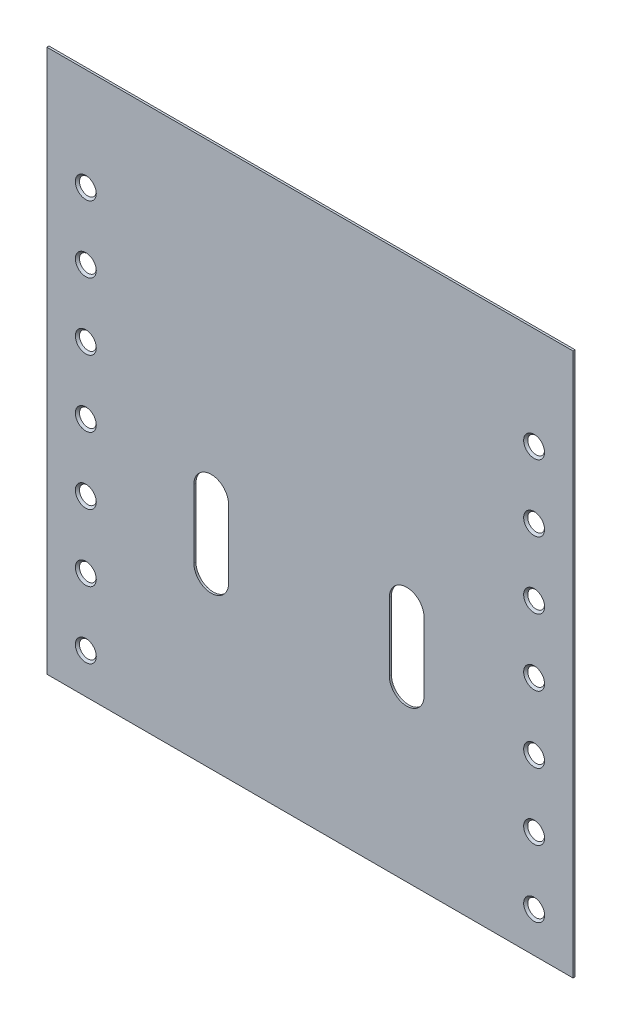
from build123d import *

# Parameters (mm, degrees)
SKETCH1_W                                      = 196.85
SKETCH1_H                                      = 203.2
BOSS_EXTRUDE1_DEPTH                            = 0.7747
CUT_EXTRUDE7_DEPTH                             = 313.185586086
SKETCH4_W                                      = 196.85
SKETCH4_H                                      = 0.6096
BOSS_EXTRUDE2_DEPTH                            = 12
SKETCH14_W                                     = 196.85
SKETCH14_H                                     = 11.938
BOSS_EXTRUDE3_DEPTH                            = 0.7747
SKETCH13_W                                     = 196.85
SKETCH13_H                                     = 0.6096
CUT_EXTRUDE9_DEPTH                             = 12
CSK_FOR_M3_FLAT_HEAD_MACHINE_SCREW3_AT_2_COUNT = 2
CSK_FOR_M3_FLAT_HEAD_MACHINE_SCREW3_AT_2_PITCH = 150
CSK_FOR_M3_FLAT_HEAD_MACHINE_SCREW3_AT_3_COUNT = 2
CSK_FOR_M3_FLAT_HEAD_MACHINE_SCREW3_AT_3_PITCH = 125
CSK_FOR_M3_FLAT_HEAD_MACHINE_SCREW3_AT_4_COUNT = 2
CSK_FOR_M3_FLAT_HEAD_MACHINE_SCREW3_AT_4_PITCH = 100
CSK_FOR_M3_FLAT_HEAD_MACHINE_SCREW3_AT_5_COUNT = 2
CSK_FOR_M3_FLAT_HEAD_MACHINE_SCREW3_AT_5_PITCH = 75
CSK_FOR_M3_FLAT_HEAD_MACHINE_SCREW3_AT_6_COUNT = 2
CSK_FOR_M3_FLAT_HEAD_MACHINE_SCREW3_AT_6_PITCH = 50
CSK_FOR_M3_FLAT_HEAD_MACHINE_SCREW3_AT_7_COUNT = 2
CSK_FOR_M3_FLAT_HEAD_MACHINE_SCREW3_AT_7_PITCH = 25


with BuildPart() as part:
    # Sketch1 → Boss-Extrude1 (new body)
    with BuildSketch(Plane(origin=(0, 0, 0), x_dir=(1, 0, 0), z_dir=(0, 0, -1))):
        with Locations((-104.775, 135.4)):
            Rectangle(SKETCH1_W, SKETCH1_H)
    extrude(amount=BOSS_EXTRUDE1_DEPTH)

    # Sketch2 → Cut-Extrude7 (cut, through all)
    with BuildSketch(Plane(origin=(0, 0, -0.7747), x_dir=(1, 0, 0), z_dir=(0, 0, -1))):
        with BuildLine():
            Line((-135.221253236, 173.5), (-135.221253236, 148))
            ThreePointArc((-135.221253236, 148), (-141.721253236, 141.5), (-148.221253236, 148))
            Line((-148.221253236, 148), (-148.221253236, 173.5))
            ThreePointArc((-148.221253236, 173.5), (-141.721253236, 180), (-135.221253236, 173.5))
        make_face()
        with BuildLine():
            Line((-62.069253236, 173.5), (-62.069253236, 148))
            ThreePointArc((-62.069253236, 148), (-68.569253236, 141.5), (-75.069253236, 148))
            Line((-75.069253236, 148), (-75.069253236, 173.5))
            ThreePointArc((-75.069253236, 173.5), (-68.569253236, 180), (-62.069253236, 173.5))
        make_face()
    extrude(amount=-CUT_EXTRUDE7_DEPTH, mode=Mode.SUBTRACT)

    # Sketch4 → Boss-Extrude2 (add)
    with BuildSketch(Plane.XY):
        with Locations((-104.775, -34.1048)):
            Rectangle(SKETCH4_W, SKETCH4_H)
    extrude(amount=BOSS_EXTRUDE2_DEPTH)

    # Sketch14 → Boss-Extrude3 (add)
    with BuildSketch(Plane.XY):
        with Locations((-104.775, -53.935004147)):
            Rectangle(SKETCH14_W, SKETCH14_H)
    extrude(amount=-BOSS_EXTRUDE3_DEPTH)

    # Sketch13 → Cut-Extrude9 (cut)
    with BuildSketch(Plane.XY.offset(12)):
        with Locations((-104.775, -34.1048)):
            Rectangle(SKETCH13_W, SKETCH13_H)
    extrude(amount=-CUT_EXTRUDE9_DEPTH, mode=Mode.SUBTRACT)

    # Sketch16 → CSK for M3 Flat Head Machine Screw3 (revolve, cut)
    with BuildSketch(Plane(origin=(-188.645, -72, 0), x_dir=(0, -1, 0), z_dir=(1, 0, 0))):
        Polygon((0, 0), (0, 0.7747), (1.7, 0.7747), (1.7, 2.212), (3.912, 0), align=None)
    csk_for_m3_flat_head_machine_screw3 = revolve(axis=Axis((-188.645, -72, 6.35), (0, 0, -1)), mode=Mode.SUBTRACT)

    # CSK for M3 Flat Head Machine Screw3 at 2: CSK for M3 Flat Head Machine Screw3 ×2
    with Locations(*[(0, -i * CSK_FOR_M3_FLAT_HEAD_MACHINE_SCREW3_AT_2_PITCH, 0) for i in range(1, CSK_FOR_M3_FLAT_HEAD_MACHINE_SCREW3_AT_2_COUNT)]):
        add(csk_for_m3_flat_head_machine_screw3, mode=Mode.SUBTRACT)

    # CSK for M3 Flat Head Machine Screw3 at 3: CSK for M3 Flat Head Machine Screw3 ×2
    with Locations(*[(0, -i * CSK_FOR_M3_FLAT_HEAD_MACHINE_SCREW3_AT_3_PITCH, 0) for i in range(1, CSK_FOR_M3_FLAT_HEAD_MACHINE_SCREW3_AT_3_COUNT)]):
        add(csk_for_m3_flat_head_machine_screw3, mode=Mode.SUBTRACT)

    # CSK for M3 Flat Head Machine Screw3 at 4: CSK for M3 Flat Head Machine Screw3 ×2
    with Locations(*[(0, -i * CSK_FOR_M3_FLAT_HEAD_MACHINE_SCREW3_AT_4_PITCH, 0) for i in range(1, CSK_FOR_M3_FLAT_HEAD_MACHINE_SCREW3_AT_4_COUNT)]):
        add(csk_for_m3_flat_head_machine_screw3, mode=Mode.SUBTRACT)

    # CSK for M3 Flat Head Machine Screw3 at 5: CSK for M3 Flat Head Machine Screw3 ×2
    with Locations(*[(0, -i * CSK_FOR_M3_FLAT_HEAD_MACHINE_SCREW3_AT_5_PITCH, 0) for i in range(1, CSK_FOR_M3_FLAT_HEAD_MACHINE_SCREW3_AT_5_COUNT)]):
        add(csk_for_m3_flat_head_machine_screw3, mode=Mode.SUBTRACT)

    # CSK for M3 Flat Head Machine Screw3 at 6: CSK for M3 Flat Head Machine Screw3 ×2
    with Locations(*[(0, -i * CSK_FOR_M3_FLAT_HEAD_MACHINE_SCREW3_AT_6_PITCH, 0) for i in range(1, CSK_FOR_M3_FLAT_HEAD_MACHINE_SCREW3_AT_6_COUNT)]):
        add(csk_for_m3_flat_head_machine_screw3, mode=Mode.SUBTRACT)

    # CSK for M3 Flat Head Machine Screw3 at 7: CSK for M3 Flat Head Machine Screw3 ×2
    with Locations(*[(0, -i * CSK_FOR_M3_FLAT_HEAD_MACHINE_SCREW3_AT_7_PITCH, 0) for i in range(1, CSK_FOR_M3_FLAT_HEAD_MACHINE_SCREW3_AT_7_COUNT)]):
        add(csk_for_m3_flat_head_machine_screw3, mode=Mode.SUBTRACT)

    # Mirror1: CSK for M3 Flat Head Machine Screw3 across plane
    add(csk_for_m3_flat_head_machine_screw3.mirror(Plane.ZY.offset(104.774999995)), mode=Mode.SUBTRACT)

    # Mirror1 copy 1 sketch → Mirror1 copy 1 (revolve, cut)
    with BuildSketch(Plane(origin=(-20.904999999, -222.000000003, 0), x_dir=(-3.839898042745385e-11, -1.0, 0), z_dir=(-1.0, 3.839898042745385e-11, 0))):
        Polygon((0, 0), (0, -0.7747), (1.7, -0.7747), (1.7, -2.212), (3.912, 0), align=None)
    revolve(axis=Axis((-20.904999999, -222.000000003, 6.35), (0, 0, 1)), mode=Mode.SUBTRACT)

    # Mirror1 copy 2 sketch → Mirror1 copy 2 (revolve, cut)
    with BuildSketch(Plane(origin=(-20.904999998, -197.000000003, 0), x_dir=(-3.839898042745385e-11, -1.0, 0), z_dir=(-1.0, 3.839898042745385e-11, 0))):
        Polygon((0, 0), (0, -0.7747), (1.7, -0.7747), (1.7, -2.212), (3.912, 0), align=None)
    revolve(axis=Axis((-20.904999998, -197.000000003, 6.35), (0, 0, 1)), mode=Mode.SUBTRACT)

    # Mirror1 copy 3 sketch → Mirror1 copy 3 (revolve, cut)
    with BuildSketch(Plane(origin=(-20.904999998, -172.000000003, 0), x_dir=(-3.839898042745385e-11, -1.0, 0), z_dir=(-1.0, 3.839898042745385e-11, 0))):
        Polygon((0, 0), (0, -0.7747), (1.7, -0.7747), (1.7, -2.212), (3.912, 0), align=None)
    revolve(axis=Axis((-20.904999998, -172.000000003, 6.35), (0, 0, 1)), mode=Mode.SUBTRACT)

    # Mirror1 copy 4 sketch → Mirror1 copy 4 (revolve, cut)
    with BuildSketch(Plane(origin=(-20.904999997, -147.000000003, 0), x_dir=(-3.839898042745385e-11, -1.0, 0), z_dir=(-1.0, 3.839898042745385e-11, 0))):
        Polygon((0, 0), (0, -0.7747), (1.7, -0.7747), (1.7, -2.212), (3.912, 0), align=None)
    revolve(axis=Axis((-20.904999997, -147.000000003, 6.35), (0, 0, 1)), mode=Mode.SUBTRACT)

    # Mirror1 copy 5 sketch → Mirror1 copy 5 (revolve, cut)
    with BuildSketch(Plane(origin=(-20.904999996, -122.000000003, 0), x_dir=(-3.839898042745385e-11, -1.0, 0), z_dir=(-1.0, 3.839898042745385e-11, 0))):
        Polygon((0, 0), (0, -0.7747), (1.7, -0.7747), (1.7, -2.212), (3.912, 0), align=None)
    revolve(axis=Axis((-20.904999996, -122.000000003, 6.35), (0, 0, 1)), mode=Mode.SUBTRACT)

    # Mirror1 copy 6 sketch → Mirror1 copy 6 (revolve, cut)
    with BuildSketch(Plane(origin=(-20.904999995, -97.000000003, 0), x_dir=(-3.839898042745385e-11, -1.0, 0), z_dir=(-1.0, 3.839898042745385e-11, 0))):
        Polygon((0, 0), (0, -0.7747), (1.7, -0.7747), (1.7, -2.212), (3.912, 0), align=None)
    revolve(axis=Axis((-20.904999995, -97.000000003, 6.35), (0, 0, 1)), mode=Mode.SUBTRACT)


solid = part.part
